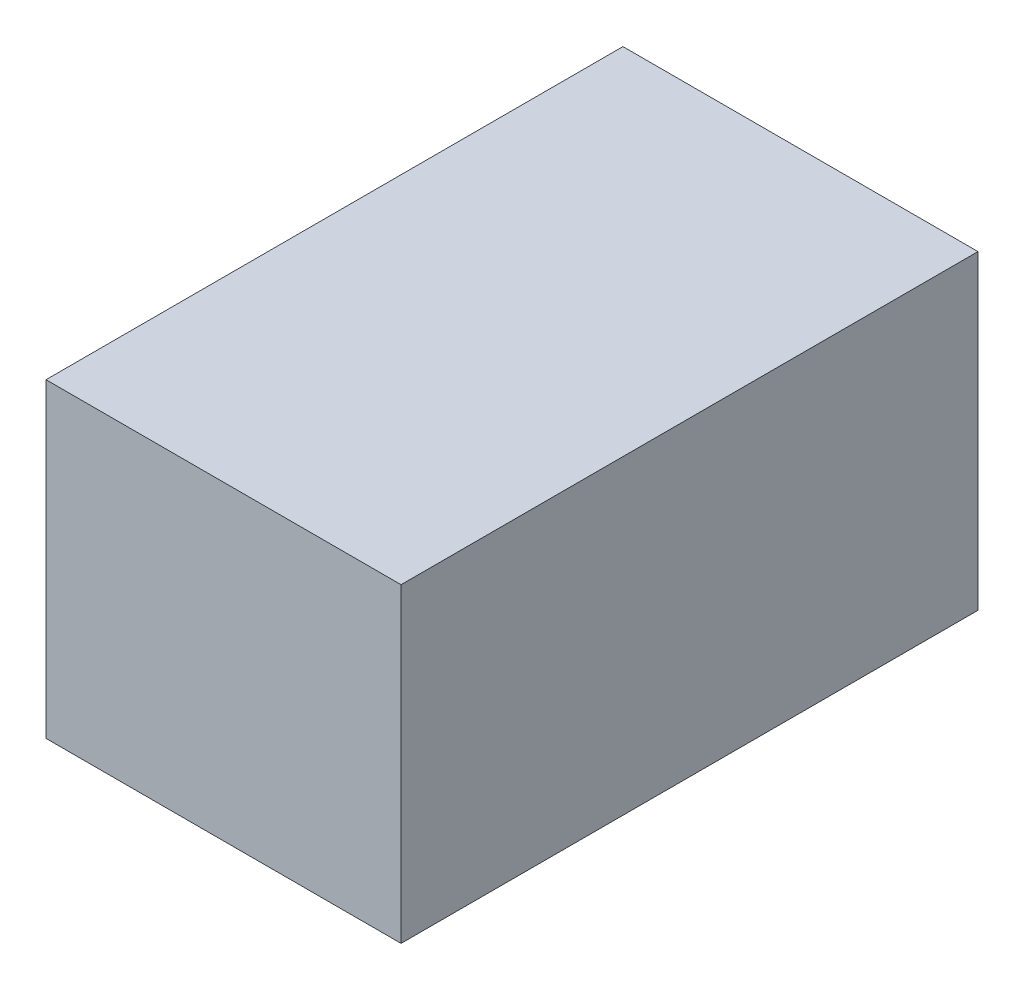
from build123d import *

# Parameters (mm, degrees)
SKETCH1_W           = 2600
SKETCH1_H           = 1400
BOSS_EXTRUDE1_DEPTH = 800


with BuildPart() as part:
    # Sketch1 → Boss-Extrude1 (new, symmetric)
    with BuildSketch(Plane(origin=(0, 0, 0), x_dir=(0, 0, -1), z_dir=(1, 0, 0))):
        with Locations((-1000, 700)):
            Rectangle(SKETCH1_W, SKETCH1_H)
    extrude(amount=BOSS_EXTRUDE1_DEPTH, both=True)


solid = part.part
